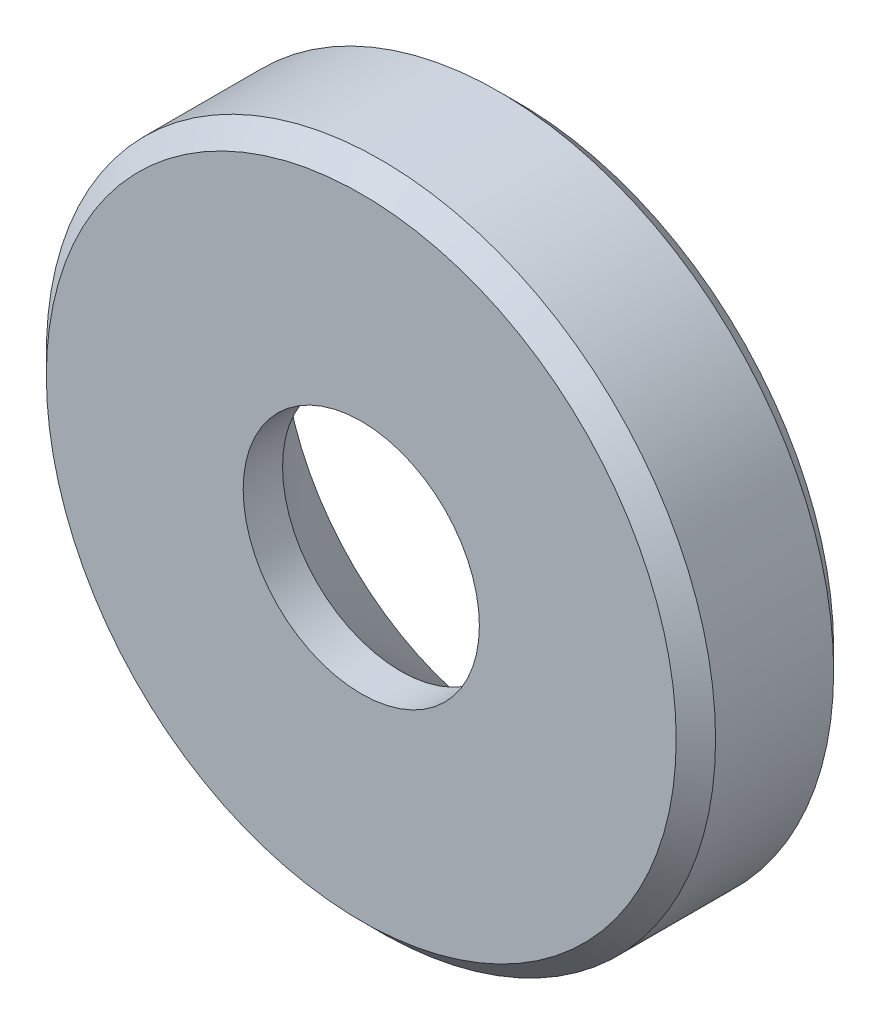
from build123d import *

# Parameters (mm, degrees)
SKETCH1_R           = 17
BOSS_EXTRUDE2_DEPTH = 8
CHAMFER1_SIZE       = 1


with BuildPart() as part:
    # Sketch1 → Boss-Extrude2 (new body)
    with BuildSketch(Plane.XY):
        Circle(SKETCH1_R)
    extrude(amount=BOSS_EXTRUDE2_DEPTH)

    # Sketch3 → Cut-Revolve2 (revolve, cut)
    with BuildSketch(Plane(origin=(0, 0, 0), x_dir=(1, 0, 0), z_dir=(0, 1, 0)), mode=Mode.PRIVATE) as cut_revolve2_sk:
        Polygon((0, 0), (0, -8), (6, -8), (6, -6), (12, 0), align=None)
    revolve(cut_revolve2_sk.sketch.rotate(Axis((0, 0, 0), (0, 0, 1)), 180), axis=Axis((0, 0, 0), (0, 0, 1)), mode=Mode.SUBTRACT)

    # Chamfer1
    chamfer1_edges = [part.edges().sort_by_distance(p)[0] for p in [
        (-17, 0, 0),
        (-17, 0, 8),
    ]]
    chamfer(chamfer1_edges, length=CHAMFER1_SIZE)


solid = part.part
